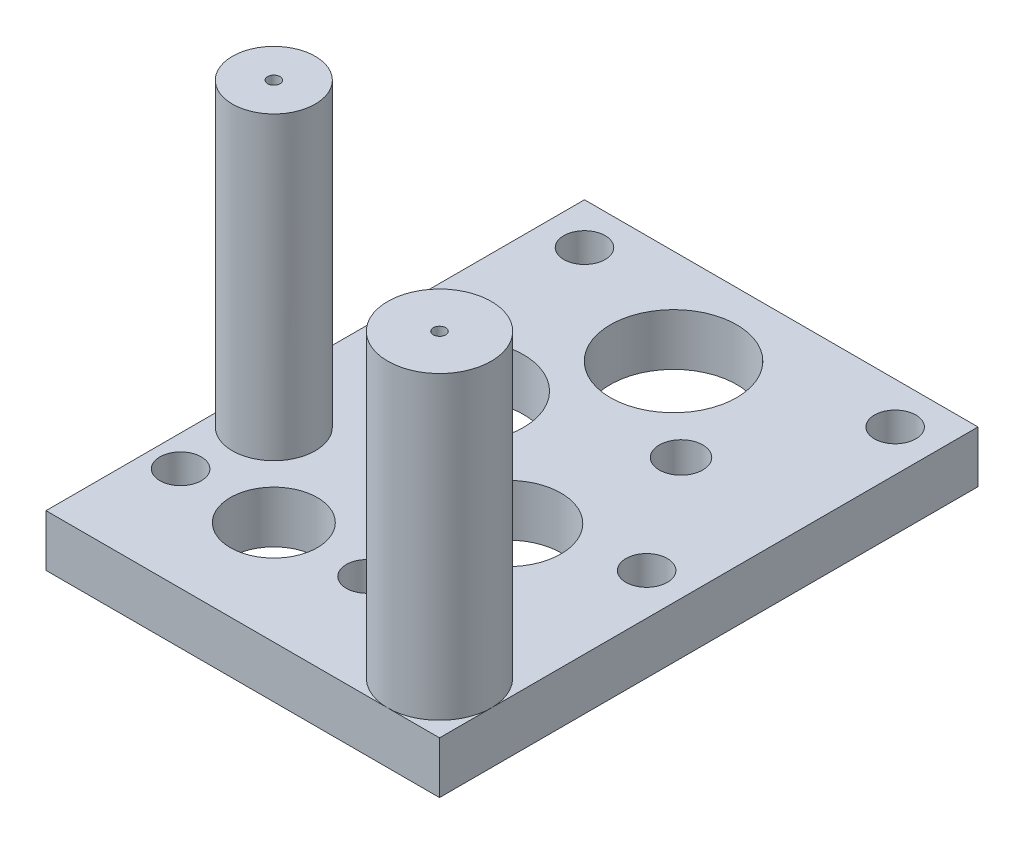
from build123d import *

# Parameters (mm, degrees)
SKETCH_1_W          = 19
SKETCH_1_H          = 26
SKETCH_1_R          = 3.05
SKETCH_1_R_2        = 1.05
SKETCH_1_R_3        = 2.1
SKETCH_1_R_4        = 2.55
EXTRUDE_1_DEPTH     = 2.5
CUT_EXTRUDE_START   = 2.5
SKETCH_1_3_R        = 1
CUT_EXTRUDE_2_DEPTH = 1.5
SKETCH_1_4_R        = 0.8
CUT_EXTRUDE_3_DEPTH = 1.5
SKETCH_2_R          = 2.5
SKETCH_2_R_2        = 2
EXTRUDE_2_DEPTH     = 14.5
CUT_EXTRUDE_START_2 = 14.5
SKETCH_2_4_R        = 0.3
CUT_EXTRUDE_6_DEPTH = 1.5
SKETCH_4_R          = 1
CUT_EXTRUDE_7_DEPTH = 1.5
SKETCH_4_3_R        = 0.7
CUT_EXTRUDE_8_DEPTH = 26.124689053
SKETCH_3_R          = 0.3
CUT_EXTRUDE_9_DEPTH = 1.5


with BuildPart() as part:
    # 草图1 → 凸台-拉伸1 (new body)
    with BuildSketch(Plane(origin=(0, 0, 0), x_dir=(1, 0, 0), z_dir=(0, 1, 0))):
        with Locations((4.5, -2)):
            Rectangle(SKETCH_1_W, SKETCH_1_H)
        with Locations(Location((0, 0, 0), (0, 0, 270))):
            Circle(SKETCH_1_R, mode=Mode.SUBTRACT)
        with Locations(Location((8.107149516, 2.554237014, 0), (0, 0, 270))):
            Circle(SKETCH_1_R_2, mode=Mode.SUBTRACT)
        with Locations(Location((3.9, 6.4, 0), (0, 0, 270))):
            Circle(SKETCH_1_R, mode=Mode.SUBTRACT)
        with Locations(Location((1, -10, 0), (0, 0, 270))):
            Circle(SKETCH_1_R_3, mode=Mode.SUBTRACT)
        with Locations(Location((6.694056557, -4.380594344, 0), (0, 0, 270))):
            Circle(SKETCH_1_R_4, mode=Mode.SUBTRACT)
    extrude(amount=EXTRUDE_1_DEPTH)

    # 草图1<3> → 切除-拉伸2 (cut)
    with BuildSketch(Plane(origin=(0, 0, 0), x_dir=(1, 0, 0), z_dir=(0, 1, 0)).offset(CUT_EXTRUDE_START)):
        with Locations(Location((-3.5, -10, 0), (0, 0, 90))):
            Circle(SKETCH_1_3_R)
        with Locations(Location((5.5, -10, 0), (0, 0, 90))):
            Circle(SKETCH_1_3_R)
    extrude(amount=-CUT_EXTRUDE_2_DEPTH, mode=Mode.SUBTRACT)

    # 草图1<4> → 切除-拉伸3 (cut)
    with BuildSketch(Plane(origin=(0, 0, 0), x_dir=(1, 0, 0), z_dir=(0, 1, 0))):
        with Locations(Location((-3.5, -10, 0), (0, 0, 90))):
            Circle(SKETCH_1_4_R)
        with Locations(Location((5.5, -10, 0), (0, 0, 90))):
            Circle(SKETCH_1_4_R)
    extrude(amount=CUT_EXTRUDE_3_DEPTH, mode=Mode.SUBTRACT)

    # 草图2 → 凸台-拉伸2 (add)
    with BuildSketch(Plane(origin=(0, 2.5, 0), x_dir=(1, 0, 0), z_dir=(0, 1, 0))):
        with Locations(Location((11.5, -12.5, 0), (0, 0, 270))):
            Circle(SKETCH_2_R)
        with Locations(Location((-3, -6, 0), (0, 0, 180))):
            Circle(SKETCH_2_R_2)
    extrude(amount=EXTRUDE_2_DEPTH)

    # 草图2<4> → 切除-拉伸6 (cut)
    with BuildSketch(Plane(origin=(0, 2.5, 0), x_dir=(1, 0, 0), z_dir=(0, 1, 0)).offset(CUT_EXTRUDE_START_2)):
        with Locations(Location((11.5, -12.5, 0), (0, 0, 270))):
            Circle(SKETCH_2_4_R)
        with Locations(Location((-3, -6, 0), (0, 0, 270))):
            Circle(SKETCH_2_4_R)
    extrude(amount=-CUT_EXTRUDE_6_DEPTH, mode=Mode.SUBTRACT)

    # 草图4 → 切除-拉伸7 (cut)
    with BuildSketch(Plane(origin=(0, 2.5, 0), x_dir=(1, 0, 0), z_dir=(0, 1, 0))):
        with Locations(Location((12, 9, 0), (0, 0, 270))):
            Circle(SKETCH_4_R)
        with Locations(Location((-3, 9, 0), (0, 0, 270))):
            Circle(SKETCH_4_R)
        with Locations(Location((12, -3, 0), (0, 0, 270))):
            Circle(SKETCH_4_R)
    extrude(amount=-CUT_EXTRUDE_7_DEPTH, mode=Mode.SUBTRACT)

    # 草图4<3> → 切除-拉伸8 (cut, through all)
    with BuildSketch(Plane(origin=(0, 2.5, 0), x_dir=(1, 0, 0), z_dir=(0, 1, 0))):
        with Locations(Location((12, 9, 0), (0, 0, 270))):
            Circle(SKETCH_4_3_R)
        with Locations(Location((-3, 9, 0), (0, 0, 270))):
            Circle(SKETCH_4_3_R)
        with Locations(Location((12, -3, 0), (0, 0, 270))):
            Circle(SKETCH_4_3_R)
    extrude(amount=-CUT_EXTRUDE_8_DEPTH, mode=Mode.SUBTRACT)

    # 草图3 → 切除-拉伸9 (cut)
    with BuildSketch(Plane.XY.offset(-11)):
        with Locations((-1, 1.25)):
            Circle(SKETCH_3_R)
        with Locations((4, 1.25)):
            Circle(SKETCH_3_R)
    extrude(amount=CUT_EXTRUDE_9_DEPTH, mode=Mode.SUBTRACT)


solid = part.part
